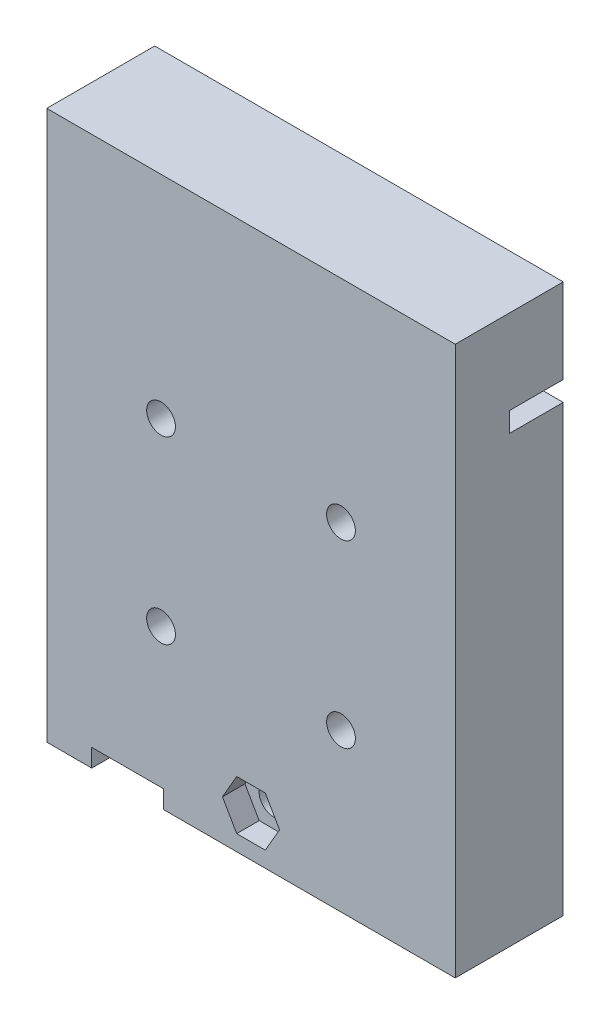
from build123d import *

# Parameters (mm, degrees)
SKETCH_1_W          = 45.4
SKETCH_1_H          = 27
EXTRUDE_1_DEPTH     = 7
SKETCH_2_R          = 1.6
CUT_EXTRUDE_1_DEPTH = 62.727033531
SKETCH_4_R          = 3.1
EXTRUDE_2_DEPTH     = 5
SKETCH_5_W          = 45.4
SKETCH_5_H          = 12
EXTRUDE_3_DEPTH     = 20
SKETCH_7_R          = 5
CUT_EXTRUDE_3_DEPTH = 6
EXTRUDE_4_DEPTH     = 14
SKETCH_9_R          = 1.6
CUT_EXTRUDE_4_DEPTH = 74.531810641
CUT_EXTRUDE_5_DEPTH = 2.5
SKETCH_10_W         = 8
SKETCH_10_H         = 12
CUT_EXTRUDE_6_DEPTH = 2
SKETCH_12_R         = 2.2
CUT_EXTRUDE_8_DEPTH = 6
SKETCH_13_R         = 2.2
CUT_EXTRUDE_9_DEPTH = 6


with BuildPart() as part:
    # 草图1 → 凸台-拉伸1 (new body)
    with BuildSketch(Plane.XY):
        with Locations((-32.096319797, 14.04251269)):
            Rectangle(SKETCH_1_W, SKETCH_1_H)
    extrude(amount=EXTRUDE_1_DEPTH)

    # 草图2 → 切除-拉伸1 (cut, through all)
    with BuildSketch(Plane(origin=(0, 0, 0), x_dir=(-1, 0, 0), z_dir=(0, 0, -1))):
        with Locations((22.096319797, 24.04251269)):
            Circle(SKETCH_2_R)
        with Locations(Location((42.096319797, 24.04251269, 0), (0, 0, 180))):
            Circle(SKETCH_2_R)
        with Locations((42.096319797, 4.04251269)):
            Circle(SKETCH_2_R)
        with Locations(Location((22.096319797, 4.04251269, 0), (0, 0, 180))):
            Circle(SKETCH_2_R)
    extrude(amount=-CUT_EXTRUDE_1_DEPTH, mode=Mode.SUBTRACT)

    # 草图4 → 凸台-拉伸2 (add)
    with BuildSketch(Plane(origin=(0, 0, 0), x_dir=(-1, 0, 0), z_dir=(0, 0, -1))):
        Polygon((38.346319797, 0.54251269), (54.796319797, 0.54251269), (54.796319797, 27.54251269), (9.396319797, 27.54251269), (9.396319797, 0.54251269), (25.846319797, 0.54251269), (25.846319797, 4.54251269), (38.346319797, 4.54251269), align=None)
        with Locations(Location((42.096319797, 24.04251269, 0), (0, 0, 180))):
            Circle(SKETCH_4_R, mode=Mode.SUBTRACT)
        with Locations((22.096319797, 24.04251269)):
            Circle(SKETCH_4_R, mode=Mode.SUBTRACT)
        with Locations((42.096319797, 4.04251269)):
            Circle(SKETCH_4_R, mode=Mode.SUBTRACT)
        with Locations(Location((22.096319797, 4.04251269, 0), (0, 0, 180))):
            Circle(SKETCH_4_R, mode=Mode.SUBTRACT)
    extrude(amount=EXTRUDE_2_DEPTH)

    # 草图5 → 凸台-拉伸3 (add)
    with BuildSketch(Plane(origin=(0, 27.54251269, 0), x_dir=(1, 0, 0), z_dir=(0, 1, 0))):
        with Locations((-32.096319797, -1)):
            Rectangle(SKETCH_5_W, SKETCH_5_H)
    extrude(amount=EXTRUDE_3_DEPTH)

    # 草图7 → 切除-拉伸3 (cut)
    with BuildSketch(Plane(origin=(0, 0, -5), x_dir=(-1, 0, 0), z_dir=(0, 0, -1))):
        with BuildLine():
            Line((9.396319797, 38.14251269), (16.375464574, 38.14251269))
            ThreePointArc((16.375464574, 38.14251269), (18.004881648, 38.623584347), (19.111721141, 39.91251269))
            ThreePointArc((19.111721141, 39.91251269), (24.873653651, 44.014763896), (31.271319797, 40.998441785))
            ThreePointArc((31.271319797, 40.998441785), (32.096319797, 40.563574513), (32.921319797, 40.998441785))
            ThreePointArc((32.921319797, 40.998441785), (39.318985943, 44.014763896), (45.080918453, 39.91251269))
            ThreePointArc((45.080918453, 39.91251269), (46.187757946, 38.623584347), (47.81717502, 38.14251269))
            Line((47.81717502, 38.14251269), (54.796319797, 38.14251269))
            Line((54.796319797, 38.14251269), (54.796319797, 35.94251269))
            Line((54.796319797, 35.94251269), (47.81717502, 35.94251269))
            ThreePointArc((47.81717502, 35.94251269), (46.187757946, 35.461441034), (45.080918453, 34.17251269))
            ThreePointArc((45.080918453, 34.17251269), (39.318985943, 30.070261485), (32.921319797, 33.086583596))
            ThreePointArc((32.921319797, 33.086583596), (32.096319797, 33.521450868), (31.271319797, 33.086583596))
            ThreePointArc((31.271319797, 33.086583596), (24.873653651, 30.070261485), (19.111721141, 34.17251269))
            ThreePointArc((19.111721141, 34.17251269), (18.004881648, 35.461441034), (16.375464574, 35.94251269))
            Line((16.375464574, 35.94251269), (9.396319797, 35.94251269))
            Line((9.396319797, 35.94251269), (9.396319797, 38.14251269))
        make_face()
        with Locations((25.496319797, 37.04251269)):
            Circle(SKETCH_7_R, mode=Mode.SUBTRACT)
        with Locations(Location((38.696319797, 37.04251269, 0), (0, 0, 180))):
            Circle(SKETCH_7_R, mode=Mode.SUBTRACT)
    extrude(amount=-CUT_EXTRUDE_3_DEPTH, mode=Mode.SUBTRACT)

    # 草图8 → 凸台-拉伸4 (add)
    with BuildSketch(Plane.XZ.offset(-0.54251269)):
        Polygon((-38.346319797, -5), (-38.346319797, 0), (-25.846319797, 0), (-25.846319797, -5), (-9.396319797, -5), (-9.396319797, 7), (-54.796319797, 7), (-54.796319797, -5), align=None)
    extrude(amount=EXTRUDE_4_DEPTH)

    # 草图9 → 切除-拉伸4 (cut, through all)
    with BuildSketch(Plane.XY.offset(7)):
        with Locations((-32.096319797, -8.95748731)):
            Circle(SKETCH_9_R)
    extrude(amount=-CUT_EXTRUDE_4_DEPTH, mode=Mode.SUBTRACT)

    # 草图3 → 切除-拉伸5 (cut)
    with BuildSketch(Plane.XY.offset(7)):
        Polygon((-28.920893316, -8.95748731), (-30.508606557, -6.20748731), (-33.684033037, -6.20748731), (-35.271746277, -8.95748731), (-33.684033037, -11.70748731), (-30.508606557, -11.70748731), align=None)
    extrude(amount=-CUT_EXTRUDE_5_DEPTH, mode=Mode.SUBTRACT)

    # 草图10 → 切除-拉伸6 (cut)
    with BuildSketch(Plane.XZ.offset(13.45748731)):
        with Locations((-45.796319797, 1)):
            Rectangle(SKETCH_10_W, SKETCH_10_H)
    extrude(amount=-CUT_EXTRUDE_6_DEPTH, mode=Mode.SUBTRACT)

    # 草图12 → 切除-拉伸8 (cut)
    with BuildSketch(Plane.XZ.offset(11.45748731)):
        with Locations(Location((-45.796319797, 1, 0), (0, 0, 270))):
            Circle(SKETCH_12_R)
    extrude(amount=-CUT_EXTRUDE_8_DEPTH, mode=Mode.SUBTRACT)

    # 草图13 → 切除-拉伸9 (cut)
    with BuildSketch(Plane(origin=(0, 0, -5), x_dir=(-1, 0, 0), z_dir=(0, 0, -1))):
        with Locations((32.096319797, 14.04251269)):
            Circle(SKETCH_13_R)
    extrude(amount=-CUT_EXTRUDE_9_DEPTH, mode=Mode.SUBTRACT)


solid = part.part
